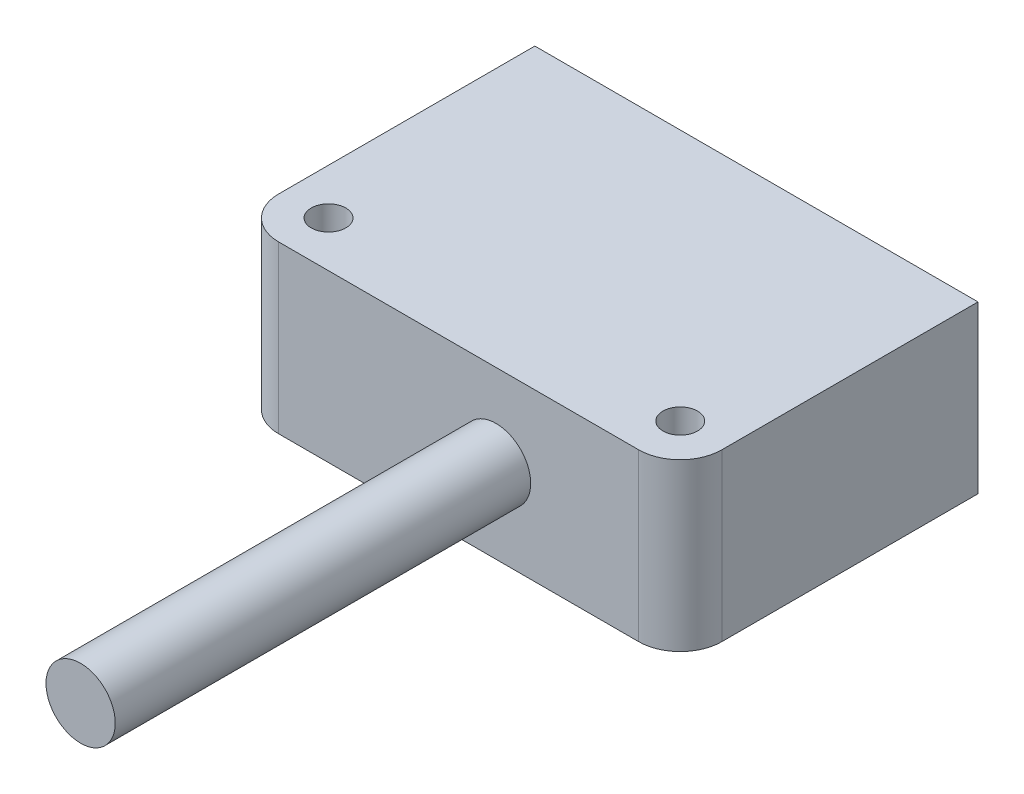
from build123d import *

# Parameters (mm, degrees)
SKETCH_1_W         = 32
SKETCH_1_H         = 21.5
EXTRUDE_1_DEPTH    = 12
HOLE_WIZARD_M3_1_D = 2.5
FILLET_1_R         = 3
SKETCH_4_R         = 2.5
EXTRUDE_2_DEPTH    = 30


with BuildPart() as part:
    # 草图1 → 凸台-拉伸1 (new body)
    with BuildSketch(Plane(origin=(0, 0, 0), x_dir=(1, 0, 0), z_dir=(0, 1, 0))):
        Rectangle(SKETCH_1_W, SKETCH_1_H)
    extrude(amount=EXTRUDE_1_DEPTH)

    # M3 螺纹孔1 (through all)
    with Locations(Plane(origin=(0, 12, 0), x_dir=(1, 0, 0), z_dir=(0, 1, 0))):
        with Locations((-12.7, -7.45), (12.7, -7.45)):
            Hole(HOLE_WIZARD_M3_1_D / 2)

    # 圆角1
    fillet_1_edges = [part.edges().sort_by_distance(p)[0] for p in [
        (16, 6, 10.75),
        (-16, 6, 10.75),
    ]]
    fillet(fillet_1_edges, radius=FILLET_1_R)

    # 草图4 → 凸台-拉伸2 (add)
    with BuildSketch(Plane.XY.offset(10.75)):
        with Locations(Location((2.7, 6, 0), (0, 0, 180))):
            Circle(SKETCH_4_R)
    extrude(amount=EXTRUDE_2_DEPTH)


solid = part.part
